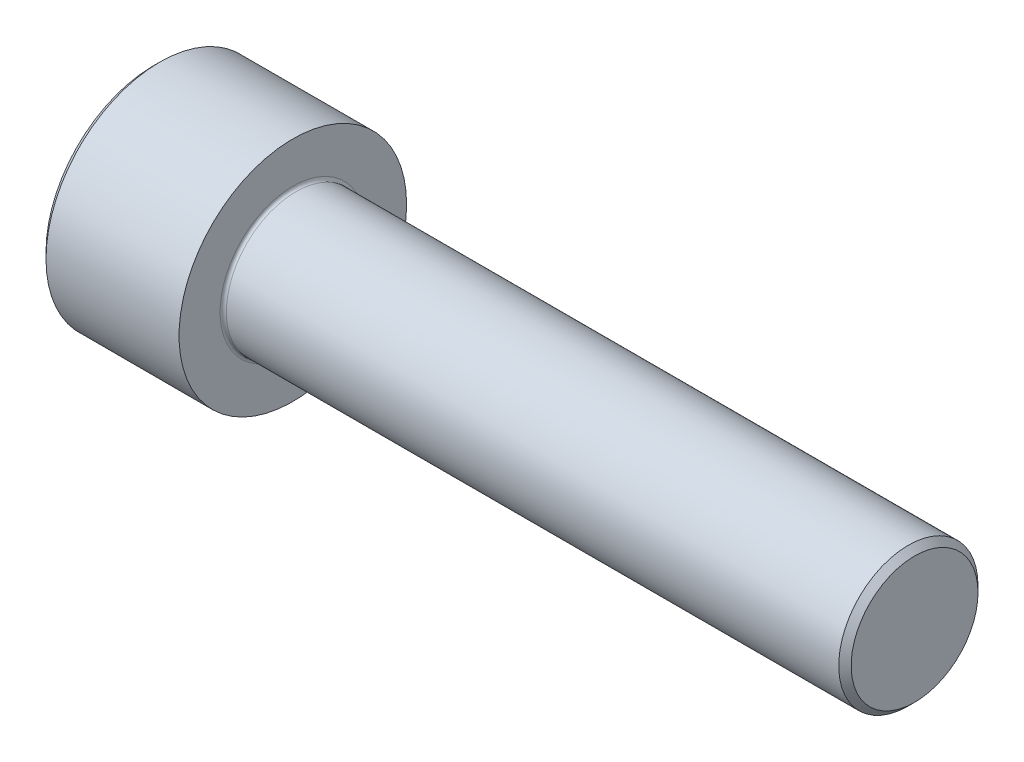
from build123d import *

# Parameters (mm, degrees)
HEX_START     = -1.896533
HEX_2_DEPTH   = 1.896533
CHAMFER1_SIZE = 0.127
FILLET1_R     = 0.0635


with BuildPart() as part:
    # Sketch1 → Body (revolve)
    with BuildSketch(Plane(origin=(0, 0, 0), x_dir=(1, 0, 0), z_dir=(0, 1, 0))):
        Polygon((0, 0), (0, 2.3241), (2.8448, 2.3241), (2.8448, 1.4224), (15.5448, 1.4224), (15.5448, 0), align=None)
    revolve(axis=Axis((15.5448, 0, 0), (-1, 0, 0)))

    # Sketch2 → Hex 2 (cut)
    with BuildSketch(Plane.ZY.offset(HEX_START)):
        Polygon((-1.374815329, 0), (-0.687407664, -1.190625), (0.687407664, -1.190625), (1.374815329, 0), (0.687407664, 1.190625), (-0.687407664, 1.190625), align=None)
    extrude(amount=HEX_2_DEPTH, mode=Mode.SUBTRACT)

    # Chamfer1
    chamfer1_edges = [part.edges().sort_by_distance(p)[0] for p in [
        (0, 0, 2.3241),
        (15.5448, 0, 1.4224),
    ]]
    chamfer(chamfer1_edges, length=CHAMFER1_SIZE)

    # Fillet1
    fillet1_edges = [part.edges().sort_by_distance(p)[0] for p in [
        (2.8448, 0, 1.4224),
    ]]
    fillet(fillet1_edges, radius=FILLET1_R)

    # Hex Chamfer cone 1 section (through the dimple's axis) → Hex Chamfer (revolve, cut)
    with BuildSketch(Plane.ZX):
        Polygon((0, 0), (1.374815329, 0), (0, 1.374815329), align=None)
    revolve(axis=Axis((0, 0, 0), (1, 0, 0)), mode=Mode.SUBTRACT)


solid = part.part
